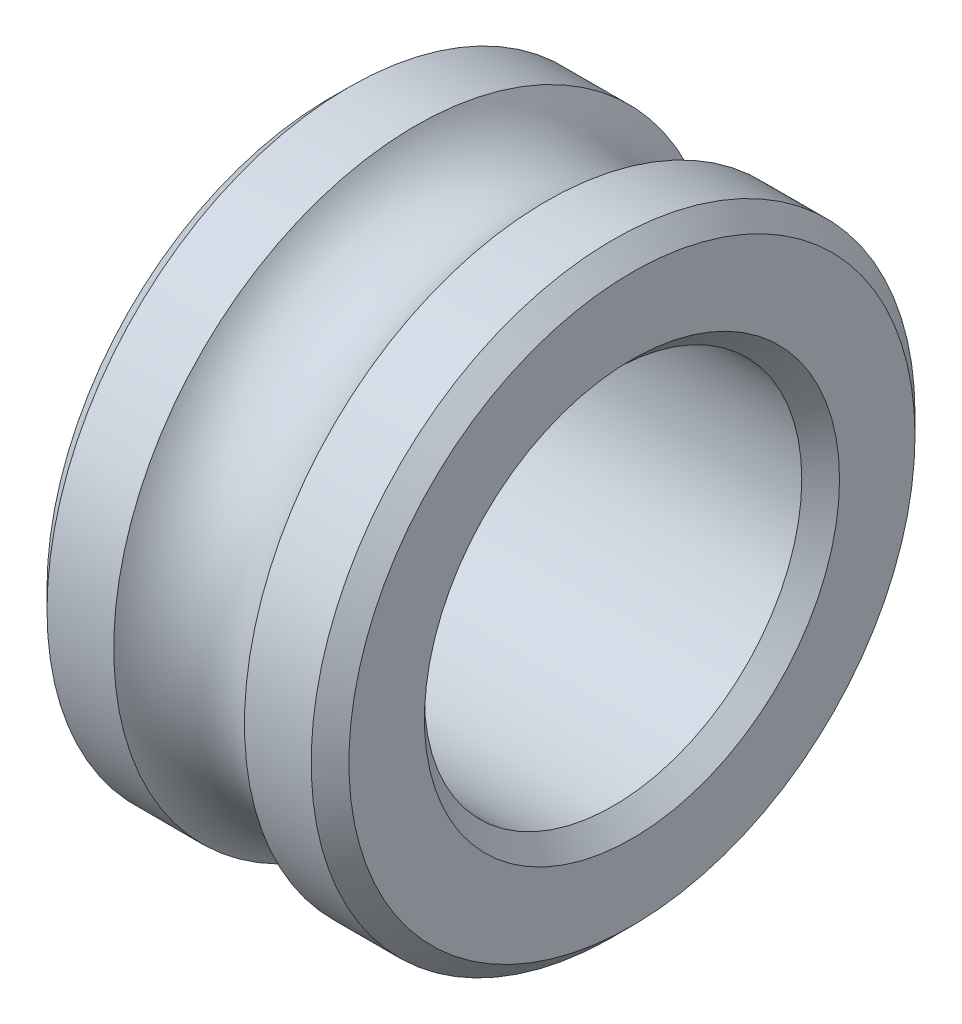
from build123d import *

# Parameters (mm, degrees)
PAH1_SIZE = 0.5


with BuildPart() as part:
    # Çizim1 → Döndür1 (revolve)
    with BuildSketch(Plane.XY, mode=Mode.PRIVATE) as d_nd_r1_sk:
        with BuildLine():
            Line((-0.523961526, 5), (-8.523961526, 5))
            Line((-8.523961526, 5), (-8.523961526, 8))
            Line((-8.523961526, 8), (-6.256012333, 8))
            ThreePointArc((-6.256012333, 8), (-4.523961526, 7), (-2.791910718, 8))
            Line((-2.791910718, 8), (-0.523961526, 8))
            Line((-0.523961526, 8), (-0.523961526, 5))
        make_face()
    revolve(d_nd_r1_sk.sketch.rotate(Axis((0, 0, 0), (-1, 0, 0)), 90), axis=Axis((0, 0, 0), (-1, 0, 0)))

    # Pah1
    pah1_edges = [part.edges().sort_by_distance(p)[0] for p in [
        (-0.523961526, 0, 5),
        (-8.523961526, 0, 5),
        (-8.523961526, 0, 8),
        (-0.523961526, 0, 8),
    ]]
    chamfer(pah1_edges, length=PAH1_SIZE)


solid = part.part
